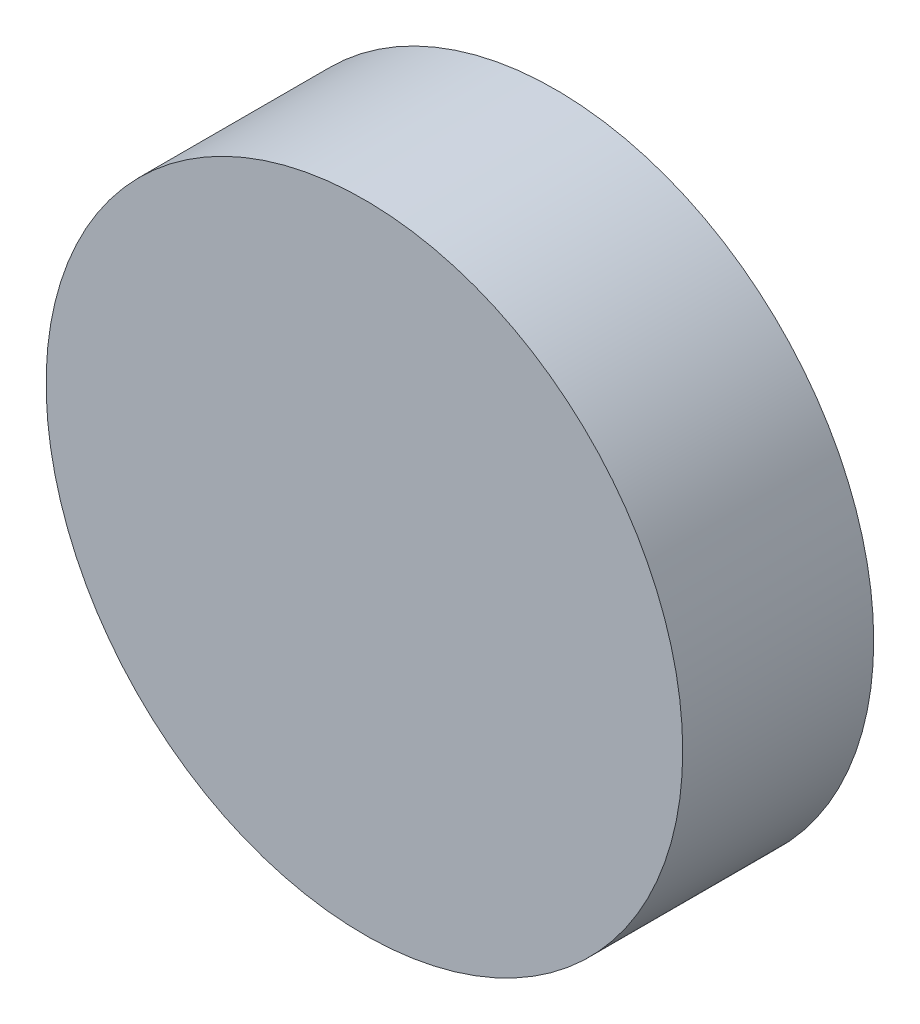
from build123d import *

# Parameters (mm, degrees)
CROQUIS1_R              = 5
SALIENTE_EXTRUIR1_DEPTH = 3


with BuildPart() as part:
    # Croquis1 → Saliente-Extruir1 (new body)
    with BuildSketch(Plane.XY):
        Circle(CROQUIS1_R)
    extrude(amount=SALIENTE_EXTRUIR1_DEPTH)


solid = part.part
